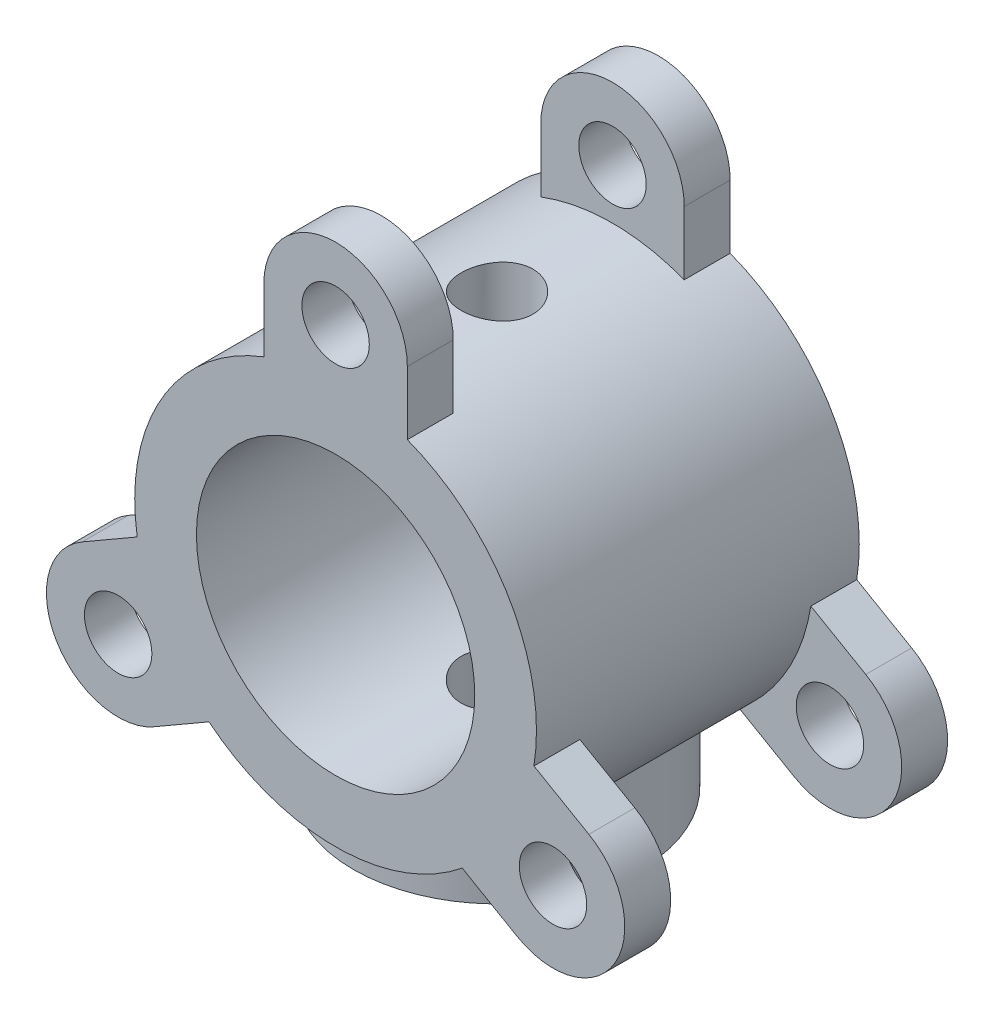
from build123d import *

# Parameters (mm, degrees)
SKETCH5_R                = 140
SKETCH5_R_2              = 97
BOSS_EXTRUDE2_DEPTH      = 225
SKETCH6_R                = 23.5
BOSS_EXTRUDE3_DEPTH      = 32
CIRPATTERN1_COUNT        = 3
MIRROR1_COPY_1_SKETCH_R  = 23.5
MIRROR1_COPY_1_DEPTH     = 32
MIRROR1_COPY_2_SKETCH_R  = 23.5
MIRROR1_COPY_2_DEPTH     = 32
BOSS_EXTRUDE4_REACH      = 491.361
BOSS_EXTRUDE4_END_RADIUS = 140
SKETCH7_R                = 100
SKETCH9_R                = 50
CUT_EXTRUDE2_DEPTH       = 25
SKETCH10_R               = 25
CUT_EXTRUDE3_DEPTH       = 470.945957604
SKETCH11_R               = 12
CUT_EXTRUDE4_DEPTH       = 15
CIRPATTERN4_COUNT        = 3


with BuildPart() as part:
    # Sketch5 → Boss-Extrude2 (new body)
    with BuildSketch(Plane.XY):
        Circle(SKETCH5_R)
        Circle(SKETCH5_R_2, mode=Mode.SUBTRACT)
    extrude(amount=BOSS_EXTRUDE2_DEPTH)

    # Sketch6 → Boss-Extrude3 (add)
    with BuildSketch(Plane.XY.offset(225)):
        with BuildLine():
            Line((50, 105.027441764), (-50, 105.027441764))
            Line((-50, 105.027441764), (-50, 174.972558236))
            ThreePointArc((-50, 174.972558236), (0, 225.000007531), (50, 174.972558236))
            Line((50, 174.972558236), (50, 105.027441764))
        make_face()
        with Locations((0, 175)):
            Circle(SKETCH6_R, mode=Mode.SUBTRACT)
    boss_extrude3 = extrude(amount=-BOSS_EXTRUDE3_DEPTH)

    # CirPattern1: Boss-Extrude3 ×3 about axis
    cirpattern1_axis = Axis((0, 0, 0), (0, 0, 1))
    for i in range(1, CIRPATTERN1_COUNT):
        add(boss_extrude3.rotate(cirpattern1_axis, i * 360 / CIRPATTERN1_COUNT))

    # Mirror1: Boss-Extrude3 across plane
    add(boss_extrude3.mirror(Plane(origin=(0, 0, 112.5), x_dir=(1, 0, 0), z_dir=(0, 0, -1))))

    # Mirror1 copy 1 sketch → Mirror1 copy 1 (add)
    with BuildSketch(Plane(origin=(0, 0, 0), x_dir=(-0.4999999999999998, 0.8660254037844387, 0), z_dir=(0, 0, -1))):
        with BuildLine():
            Line((50, -105.027441764), (-50, -105.027441764))
            Line((-50, -105.027441764), (-50, -174.972558236))
            ThreePointArc((-50, -174.972558236), (0, -225.000007531), (50, -174.972558236))
            Line((50, -174.972558236), (50, -105.027441764))
        make_face()
        with Locations((0, -175)):
            Circle(MIRROR1_COPY_1_SKETCH_R, mode=Mode.SUBTRACT)
    extrude(amount=-MIRROR1_COPY_1_DEPTH)

    # Mirror1 copy 2 sketch → Mirror1 copy 2 (add)
    with BuildSketch(Plane(origin=(0, 0, 0), x_dir=(-0.5000000000000004, -0.8660254037844384, 0), z_dir=(0, 0, -1))):
        with BuildLine():
            Line((50, -105.027441764), (-50, -105.027441764))
            Line((-50, -105.027441764), (-50, -174.972558236))
            ThreePointArc((-50, -174.972558236), (0, -225.000007531), (50, -174.972558236))
            Line((50, -174.972558236), (50, -105.027441764))
        make_face()
        with Locations((0, -175)):
            Circle(MIRROR1_COPY_2_SKETCH_R, mode=Mode.SUBTRACT)
    extrude(amount=-MIRROR1_COPY_2_DEPTH)

    # Boss-Extrude4: up to this cylinder (the profile starts outside it)
    boss_extrude4_end = Plane(origin=(0, 0, 112.5), z_dir=(0, 0, -1)) * Cylinder(BOSS_EXTRUDE4_END_RADIUS, 1263.722, mode=Mode.PRIVATE)
    # Sketch7 → Boss-Extrude4 (add, up to the surface)
    with BuildSketch(Plane(origin=(0, -160, 0), x_dir=(1, 0, 0), z_dir=(0, 1, 0)), mode=Mode.PRIVATE) as boss_extrude4_sk1:
        with Locations(Location((0, -112.5, 0), (0, 0, 90))):
            Circle(SKETCH7_R)
    boss_extrude4_tool1 = extrude(boss_extrude4_sk1.sketch, amount=BOSS_EXTRUDE4_REACH, mode=Mode.PRIVATE) - boss_extrude4_end
    add(boss_extrude4_tool1.solids().sort_by_distance((0, -160, 112.5))[0])

    # Sketch9 → Cut-Extrude2 (cut)
    with BuildSketch(Plane.XZ.offset(160)):
        with Locations(Location((0, 112.5, 0), (0, 0, 270))):
            Circle(SKETCH9_R)
    extrude(amount=-CUT_EXTRUDE2_DEPTH, mode=Mode.SUBTRACT)

    # Sketch10 → Cut-Extrude3 (cut, through all)
    with BuildSketch(Plane.XZ.offset(135)):
        with Locations(Location((0, 112.5, 0), (0, 0, 270))):
            Circle(SKETCH10_R)
    extrude(amount=-CUT_EXTRUDE3_DEPTH, mode=Mode.SUBTRACT)

    # Sketch11 → Cut-Extrude4 (cut)
    with BuildSketch(Plane.XZ.offset(160)):
        with Locations(Location((0, 187.5, 0), (0, 0, 270))):
            Circle(SKETCH11_R)
    cut_extrude4 = extrude(amount=-CUT_EXTRUDE4_DEPTH, mode=Mode.SUBTRACT)

    # CirPattern4: Cut-Extrude4 ×3 about axis
    cirpattern4_axis = Axis((0, 0, 112.5), (0, 1, 0))
    for i in range(1, CIRPATTERN4_COUNT):
        add(cut_extrude4.rotate(cirpattern4_axis, i * 360 / CIRPATTERN4_COUNT), mode=Mode.SUBTRACT)


solid = part.part
